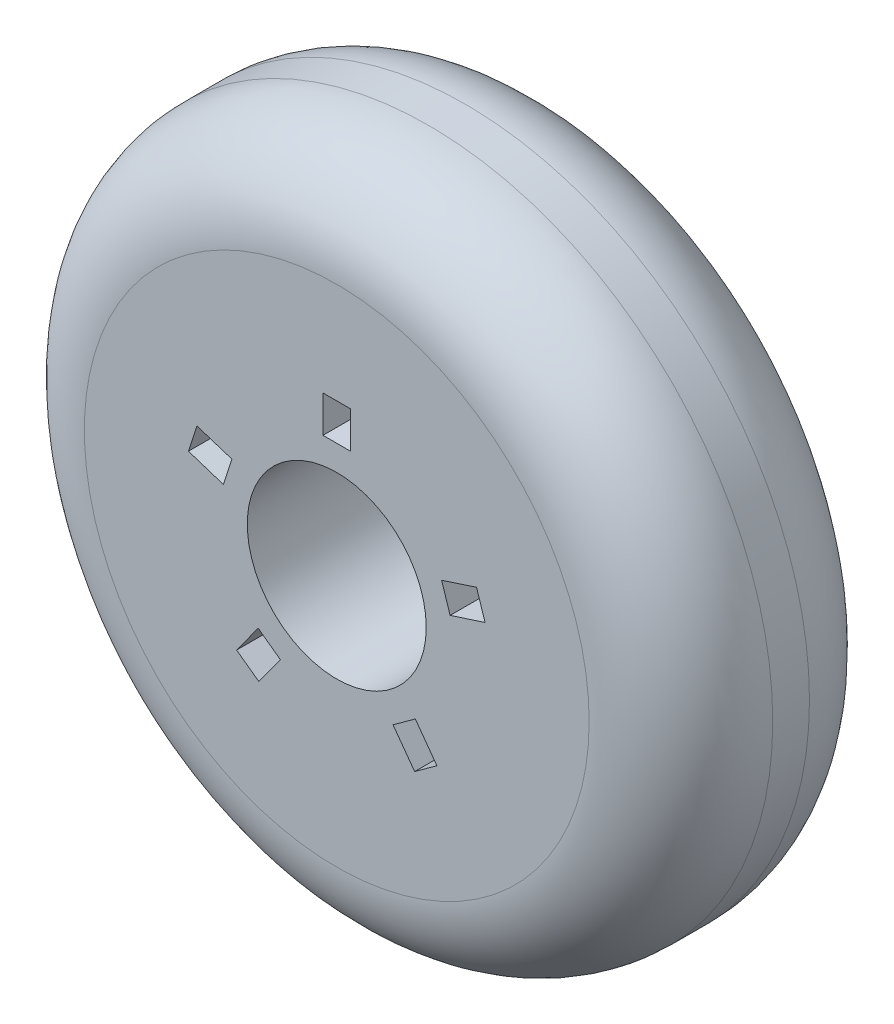
from build123d import *

# Parameters (mm, degrees)
ESQUISSE1_R             = 37.5
ESQUISSE1_R_2           = 9.75
BOSS_EXTRU_1_DEPTH      = 24
CONG_1_R                = 10
ESQUISSE3_W             = 3
ESQUISSE3_H             = 4
ENL_V_MAT_EXTRU_1_DEPTH = 59.210823736


with BuildPart() as part:
    # Esquisse1 → Boss.-Extru.1 (new body)
    with BuildSketch(Plane.XY):
        Circle(ESQUISSE1_R)
        Circle(ESQUISSE1_R_2, mode=Mode.SUBTRACT)
    extrude(amount=BOSS_EXTRU_1_DEPTH)

    # Congé1
    cong_1_edges = [part.edges().sort_by_distance(p)[0] for p in [
        (-37.5, 0, 0),
        (-37.5, 0, 24),
    ]]
    fillet(cong_1_edges, radius=CONG_1_R)

    # Esquisse3 → Enlèv. mat.-Extru.1 (cut, through all)
    with BuildSketch(Plane.XY.offset(24)):
        Polygon((15.228907027, 6.525365182), (16.15595801, 3.672195633), (12.351731945, 2.436127655), (11.424680962, 5.289297204), align=None)
        with Locations((0, 14.5)):
            Rectangle(ESQUISSE3_W, ESQUISSE3_H)
        Polygon((10.911982154, -12.467102529), (8.484931171, -14.230458286), (6.133790162, -10.994390308), (8.560841145, -9.231034551), align=None)
        Polygon((-8.484931171, -14.230458286), (-10.911982154, -12.467102529), (-8.560841145, -9.231034551), (-6.133790162, -10.994390308), align=None)
        Polygon((-16.15595801, 3.672195633), (-15.228907027, 6.525365182), (-11.424680962, 5.289297204), (-12.351731945, 2.436127655), align=None)
    extrude(amount=-ENL_V_MAT_EXTRU_1_DEPTH, mode=Mode.SUBTRACT)


solid = part.part
